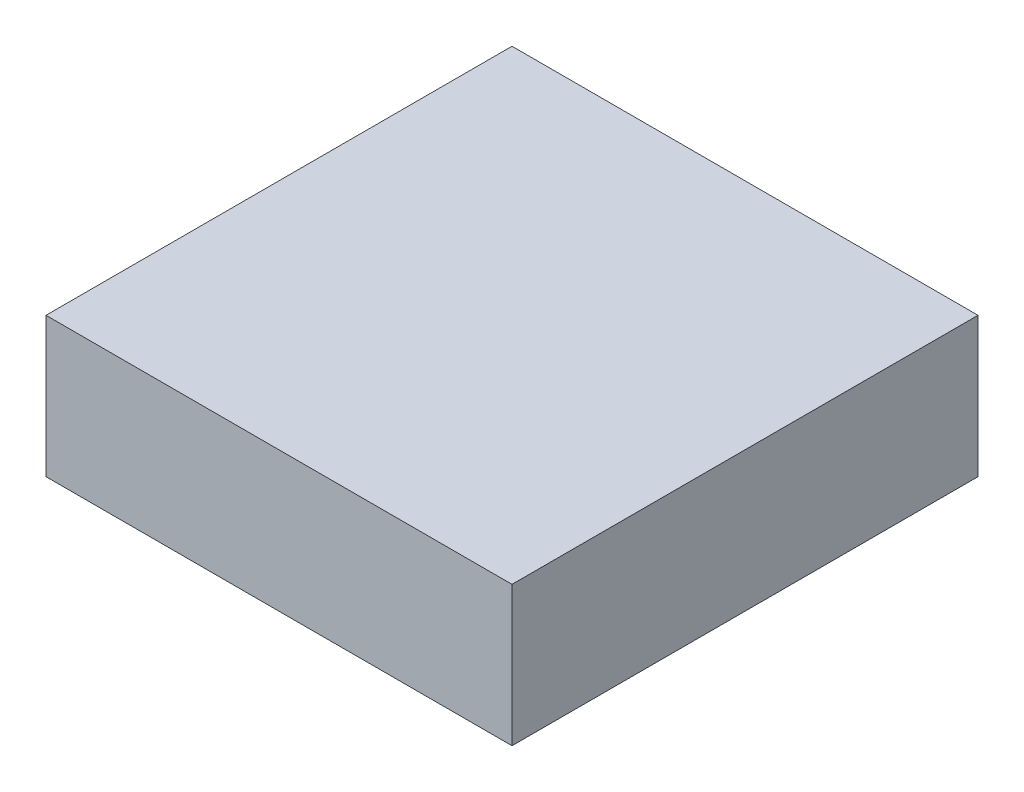
from build123d import *

# Parameters (mm, degrees)
SKETCH1_W           = 10
SKETCH1_H           = 10
BOSS_EXTRUDE1_DEPTH = 3


with BuildPart() as part:
    # Sketch1 → Boss-Extrude1 (new body)
    with BuildSketch(Plane(origin=(0, 0, 0), x_dir=(1, 0, 0), z_dir=(0, 1, 0))):
        Rectangle(SKETCH1_W, SKETCH1_H)
    extrude(amount=BOSS_EXTRUDE1_DEPTH)


solid = part.part
